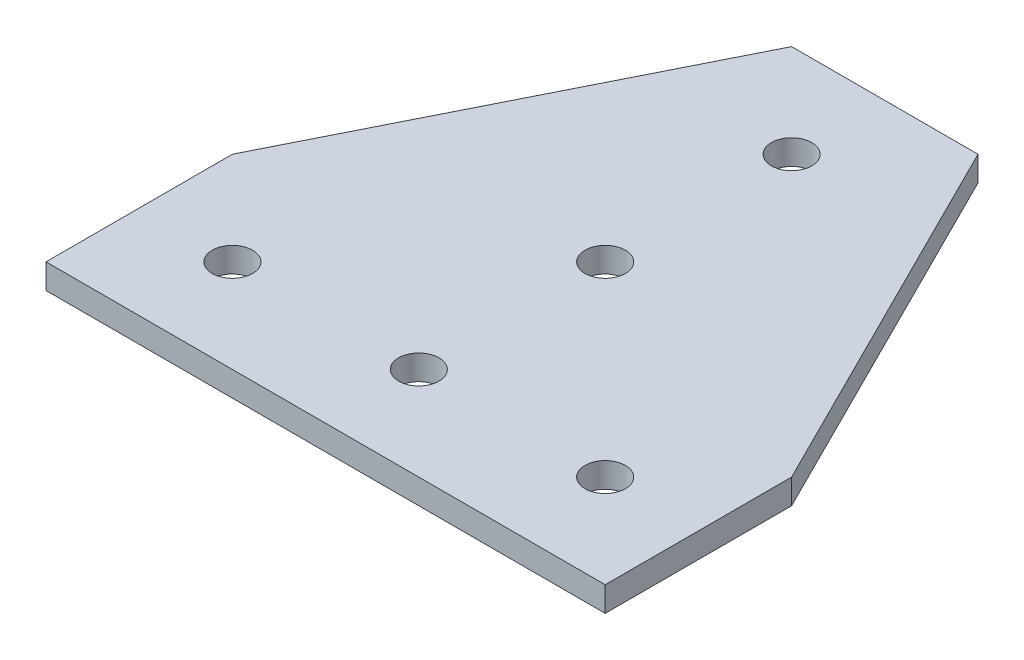
from build123d import *

# Parameters (mm, degrees)
BOSS_EXTRUDE1_DEPTH = 4
SKETCH2_R           = 3.25
CUT_EXTRUDE1_DEPTH  = 101.702532242


with BuildPart() as part:
    # Sketch1 → Boss-Extrude1 (new body)
    with BuildSketch(Plane(origin=(0, 0, 0), x_dir=(1, 0, 0), z_dir=(0, 1, 0))):
        Polygon((-45, 0), (45, 0), (45, 30), (15, 90), (-15, 90), (-45, 30), align=None)
    extrude(amount=BOSS_EXTRUDE1_DEPTH)

    # Sketch2 → Cut-Extrude1 (cut, through all)
    with BuildSketch(Plane(origin=(0, 4, 0), x_dir=(1, 0, 0), z_dir=(0, 1, 0))):
        with Locations(Location((0, 75, 0), (0, 0, 270))):
            Circle(SKETCH2_R)
        with Locations(Location((0, 45, 0), (0, 0, 270))):
            Circle(SKETCH2_R)
        with Locations(Location((0, 15, 0), (0, 0, 270))):
            Circle(SKETCH2_R)
        with Locations(Location((30, 15, 0), (0, 0, 270))):
            Circle(SKETCH2_R)
        with Locations(Location((-30, 15, 0), (0, 0, 270))):
            Circle(SKETCH2_R)
    extrude(amount=-CUT_EXTRUDE1_DEPTH, mode=Mode.SUBTRACT)


solid = part.part
